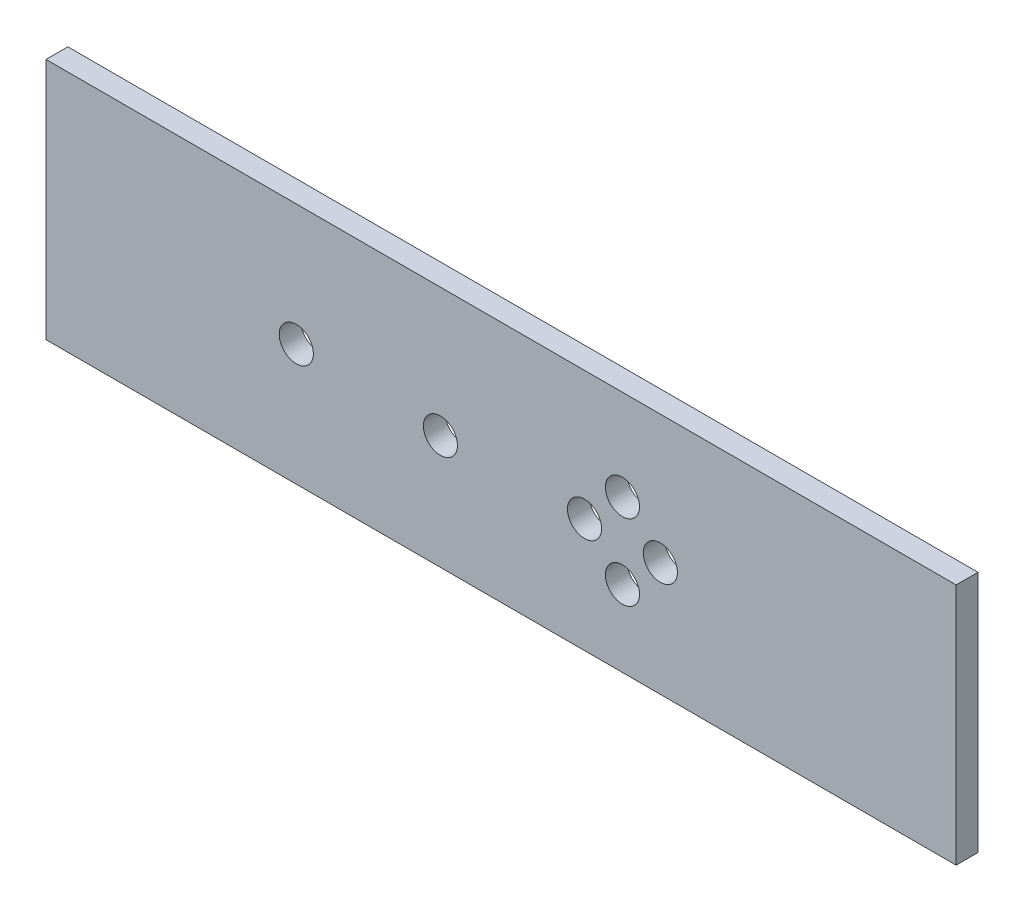
from build123d import *

# Parameters (mm, degrees)
SKETCH1_W           = 762
SKETCH1_H           = 203.2
BOSS_EXTRUDE1_DEPTH = 18.288
SKETCH2_R           = 14.2875
CUT_EXTRUDE1_DEPTH  = 499.404705003
SKETCH3_R           = 14.2875
CUT_EXTRUDE2_DEPTH  = 499.404705003


with BuildPart() as part:
    # Sketch1 → Boss-Extrude1 (new body)
    with BuildSketch(Plane.XY):
        with Locations((58.556886228, 132.62754491)):
            Rectangle(SKETCH1_W, SKETCH1_H)
    extrude(amount=BOSS_EXTRUDE1_DEPTH)

    # Sketch2 → Cut-Extrude1 (cut, through all)
    with BuildSketch(Plane(origin=(0, 0, 0), x_dir=(-1, 0, 0), z_dir=(0, 0, -1))):
        with Locations((112.893113772, 132.62754491)):
            Circle(SKETCH2_R)
    extrude(amount=-CUT_EXTRUDE1_DEPTH, mode=Mode.SUBTRACT)

    # Sketch3 → Cut-Extrude2 (cut, through all)
    with BuildSketch(Plane(origin=(0, 0, 0), x_dir=(-1, 0, 0), z_dir=(0, 0, -1))):
        with Locations((-128.406886228, 126.576648332)):
            Circle(SKETCH3_R)
        with Locations((-191.906886228, 126.576648332)):
            Circle(SKETCH3_R)
        with Locations((-160.156886228, 158.326648332)):
            Circle(SKETCH3_R)
        with Locations((-160.156886228, 94.826648332)):
            Circle(SKETCH3_R)
        with Locations((-7.756886228, 126.576648332)):
            Circle(SKETCH3_R)
    extrude(amount=-CUT_EXTRUDE2_DEPTH, mode=Mode.SUBTRACT)


solid = part.part
